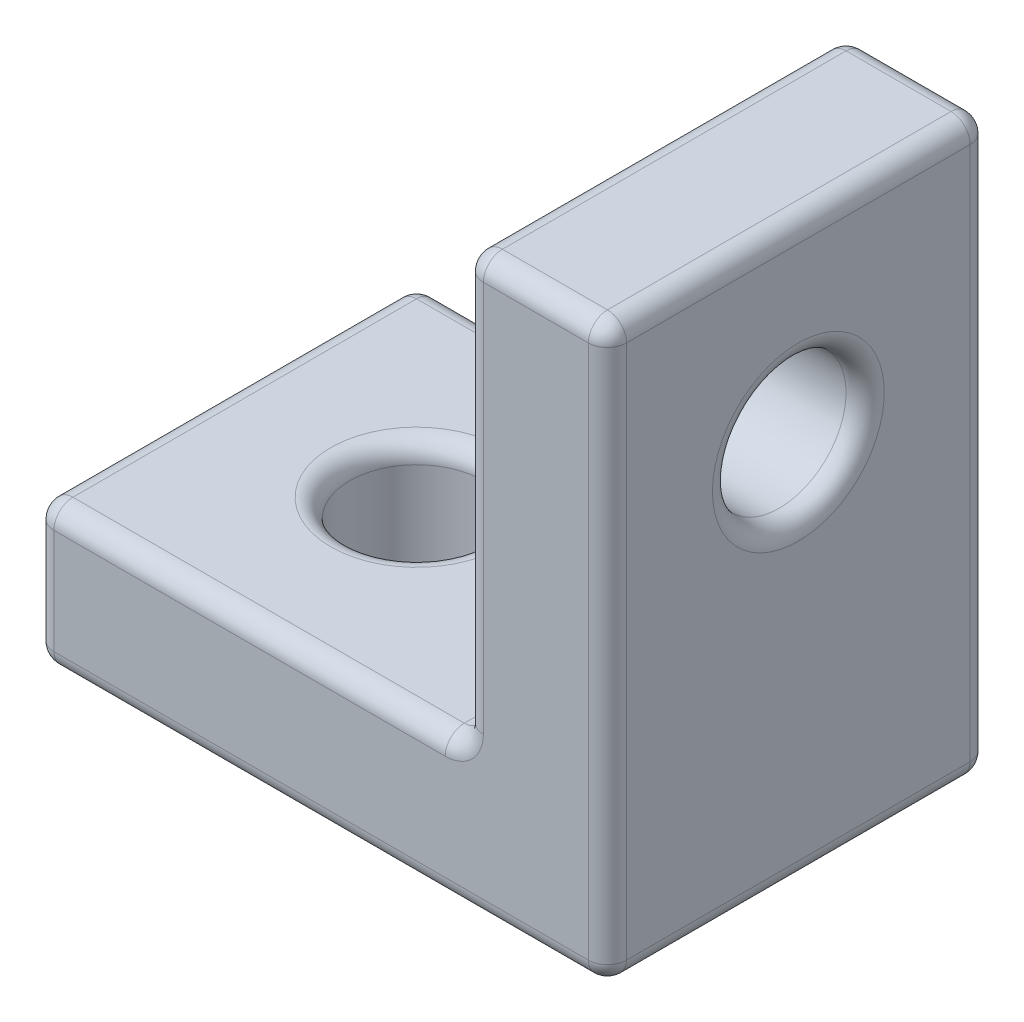
from build123d import *

# Parameters (mm, degrees)
SKETCH1_W           = 12
SKETCH1_H           = 8
SKETCH1_R           = 1.4
BOSS_EXTRUDE1_DEPTH = 3
SKETCH2_W           = 3
SKETCH2_H           = 8
BOSS_EXTRUDE2_DEPTH = 9
SKETCH3_R           = 1.4
CUT_EXTRUDE1_DEPTH  = 10
FILLET1_R           = 0.4


with BuildPart() as part:
    # Sketch1 → Boss-Extrude1 (new body)
    with BuildSketch(Plane(origin=(0, 0, 0), x_dir=(1, 0, 0), z_dir=(0, 1, 0))):
        with Locations((6, -4)):
            Rectangle(SKETCH1_W, SKETCH1_H)
        with Locations(Location((4, -4, 0), (0, 0, 270))):
            Circle(SKETCH1_R, mode=Mode.SUBTRACT)
    extrude(amount=BOSS_EXTRUDE1_DEPTH)

    # Sketch2 → Boss-Extrude2 (add)
    with BuildSketch(Plane(origin=(0, 3, 0), x_dir=(1, 0, 0), z_dir=(0, 1, 0))):
        with Locations((10.5, -4)):
            Rectangle(SKETCH2_W, SKETCH2_H)
    extrude(amount=BOSS_EXTRUDE2_DEPTH)

    # Sketch3 → Cut-Extrude1 (cut)
    with BuildSketch(Plane.ZY.offset(-9)):
        with Locations((4, 8)):
            Circle(SKETCH3_R)
    extrude(amount=-CUT_EXTRUDE1_DEPTH, mode=Mode.SUBTRACT)

    # Fillet1
    fillet1_edges = [part.edges().sort_by_distance(p)[0] for p in [
        (4, 0, 2.6),
        (4, 3, 2.6),
        (4.5, 3, 0),
        (9, 3, 4),
        (9, 7.5, 0),
        (9, 7.5, 8),
        (12, 12, 4),
        (10.5, 12, 0),
        (9, 12, 4),
        (10.5, 12, 8),
        (12, 8, 2.6),
        (9, 8, 2.6),
        (0, 3, 4),
        (6, 0, 0),
        (12, 0, 4),
        (6, 0, 8),
        (0, 0, 4),
        (0, 1.5, 0),
        (12, 6, 0),
        (12, 6, 8),
        (0, 1.5, 8),
        (4.5, 3, 8),
    ]]
    fillet(fillet1_edges, radius=FILLET1_R)


solid = part.part
